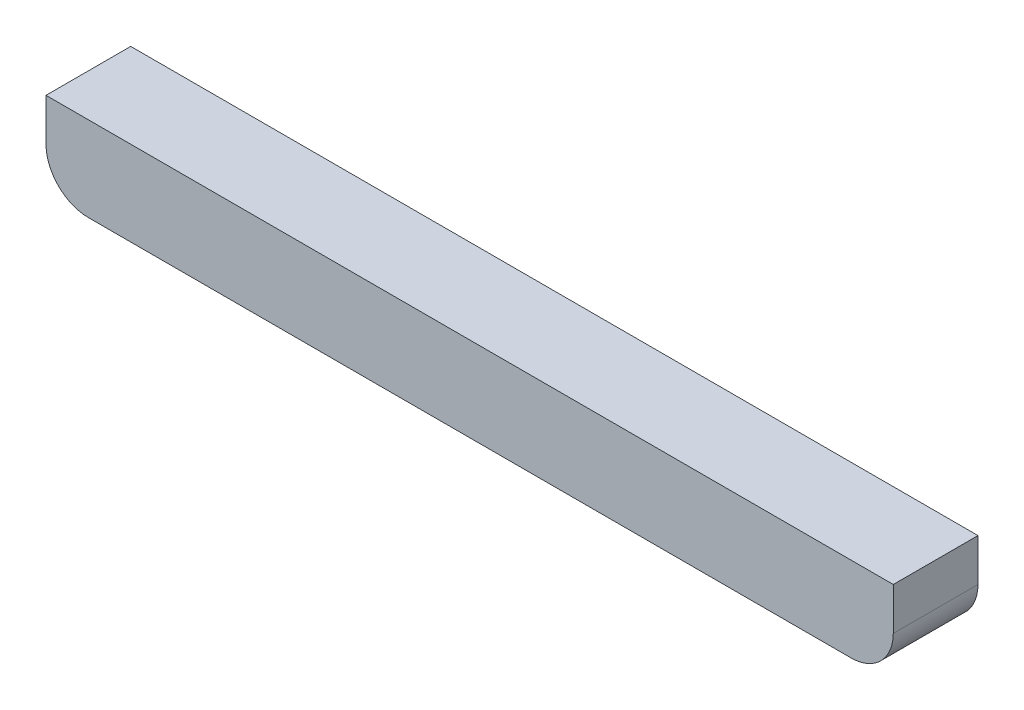
from build123d import *

# Parameters (mm, degrees)
SKETCH1_W           = 50.8
SKETCH1_H           = 5.08
BOSS_EXTRUDE1_DEPTH = 5.08
FILLET1_R           = 2.54


with BuildPart() as part:
    # Sketch1 → Boss-Extrude1 (new body)
    with BuildSketch(Plane.XY):
        with Locations((25.4, 2.54)):
            Rectangle(SKETCH1_W, SKETCH1_H)
    extrude(amount=BOSS_EXTRUDE1_DEPTH)

    # Fillet1
    fillet1_edges = [part.edges().sort_by_distance(p)[0] for p in [
        (50.8, 0, 2.54),
        (0, 0, 2.54),
    ]]
    fillet(fillet1_edges, radius=FILLET1_R)


solid = part.part
